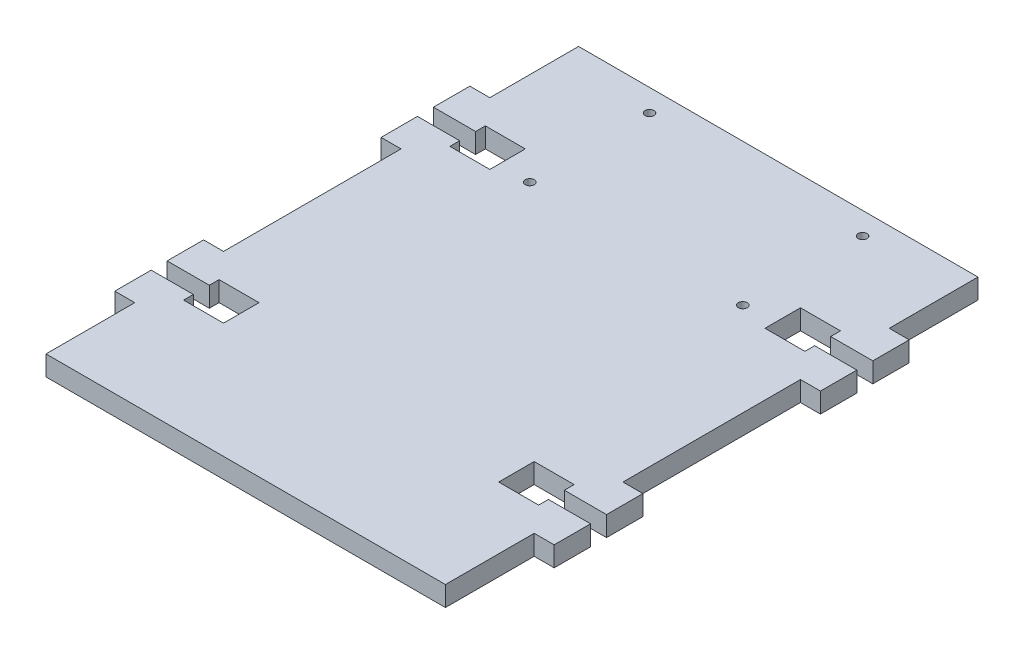
from build123d import *

# Parameters (mm, degrees)
SKETCH1_W           = 90
SKETCH1_H           = 20
SKETCH1_W_2         = 4.5
SKETCH1_H_2         = 8.2
SKETCH1_W_3         = 62
SKETCH1_H_3         = 3.6
SKETCH1_H_4         = 40
BOSS_EXTRUDE1_DEPTH = 4.5
CUT_EXTRUDE1_DEPTH  = 10


with BuildPart() as part:
    # Sketch1 → Boss-Extrude1 (new body)
    with BuildSketch(Plane(origin=(0, 0, 0), x_dir=(1, 0, 0), z_dir=(0, 1, 0))):
        with Locations((0, 50)):
            Rectangle(SKETCH1_W, SKETCH1_H)
        Polygon((-45, 40), (-45, 31.8), (-40, 31.8), (-40, 34), (-31, 34), (-31, 31.8), (31, 31.8), (31, 34), (40, 34), (40, 31.8), (45, 31.8), (45, 40), align=None)
        with Locations((-47.25, 35.9)):
            Rectangle(SKETCH1_W_2, SKETCH1_H_2)
        with Locations((-47.25, 24.1)):
            Rectangle(SKETCH1_W_2, SKETCH1_H_2)
        Polygon((-45, 28.2), (-45, 20), (45, 20), (45, 28.2), (40, 28.2), (40, 26), (31, 26), (31, 28.2), (-31, 28.2), (-31, 26), (-40, 26), (-40, 28.2), align=None)
        with Locations((0, 30)):
            Rectangle(SKETCH1_W_3, SKETCH1_H_3)
        Rectangle(SKETCH1_W, SKETCH1_H_4)
        Polygon((-45, -20), (-45, -28.2), (-40, -28.2), (-40, -26), (-31, -26), (-31, -28.2), (31, -28.2), (31, -26), (40, -26), (40, -28.2), (45, -28.2), (45, -20), align=None)
        with Locations((-47.25, -24.1)):
            Rectangle(SKETCH1_W_2, SKETCH1_H_2)
        with Locations((-47.25, -35.9)):
            Rectangle(SKETCH1_W_2, SKETCH1_H_2)
        Polygon((-45, -31.8), (-45, -40), (45, -40), (45, -31.8), (40, -31.8), (40, -34), (31, -34), (31, -31.8), (-31, -31.8), (-31, -34), (-40, -34), (-40, -31.8), align=None)
        with Locations((0, -30)):
            Rectangle(SKETCH1_W_3, SKETCH1_H_3)
        with Locations((47.25, -24.1)):
            Rectangle(SKETCH1_W_2, SKETCH1_H_2)
        with Locations((47.25, -35.9)):
            Rectangle(SKETCH1_W_2, SKETCH1_H_2)
        with Locations((47.25, 24.1)):
            Rectangle(SKETCH1_W_2, SKETCH1_H_2)
        with Locations((47.25, 35.9)):
            Rectangle(SKETCH1_W_2, SKETCH1_H_2)
        with Locations((0, -50)):
            Rectangle(SKETCH1_W, SKETCH1_H)
    extrude(amount=BOSS_EXTRUDE1_DEPTH)

    # Sketch2 → Cut-Extrude1 (cut)
    with BuildSketch(Plane(origin=(0, 4.5, 0), x_dir=(1, 0, 0), z_dir=(0, 1, 0))):
        with BuildLine():
            ThreePointArc((-23, 55), (-24.707106781, 55.707106781), (-24, 54))
            Line((-24, 54), (-24, 55))
            Line((-24, 55), (-23, 55))
        make_face()
        with BuildLine():
            Line((-24, 55), (-24, 54))
            ThreePointArc((-24, 54), (-23.292893219, 54.292893219), (-23, 55))
            Line((-23, 55), (-24, 55))
        make_face()
        with BuildLine():
            ThreePointArc((23, 55), (23.292893219, 54.292893219), (24, 54))
            Line((24, 54), (24, 55))
            Line((24, 55), (23, 55))
        make_face()
        with BuildLine():
            Line((24, 55), (24, 54))
            ThreePointArc((24, 54), (24.707106781, 54.292893219), (25, 55))
            ThreePointArc((25, 55), (24, 56), (23, 55))
            Line((23, 55), (24, 55))
        make_face()
        with BuildLine():
            ThreePointArc((24, 29), (23.292893219, 28.707106781), (23, 28))
            Line((23, 28), (24, 28))
            Line((24, 28), (24, 29))
        make_face()
        with BuildLine():
            Line((24, 28), (23, 28))
            ThreePointArc((23, 28), (24, 27), (25, 28))
            ThreePointArc((25, 28), (24.707106781, 28.707106781), (24, 29))
            Line((24, 29), (24, 28))
        make_face()
        with BuildLine():
            Line((-24, 29), (-24, 28))
            Line((-24, 28), (-23, 28))
            ThreePointArc((-23, 28), (-23.292893219, 28.707106781), (-24, 29))
        make_face()
        with BuildLine():
            Line((-23, 28), (-24, 28))
            Line((-24, 28), (-24, 29))
            ThreePointArc((-24, 29), (-24.707106781, 27.292893219), (-23, 28))
        make_face()
    extrude(amount=-CUT_EXTRUDE1_DEPTH, mode=Mode.SUBTRACT)


solid = part.part
